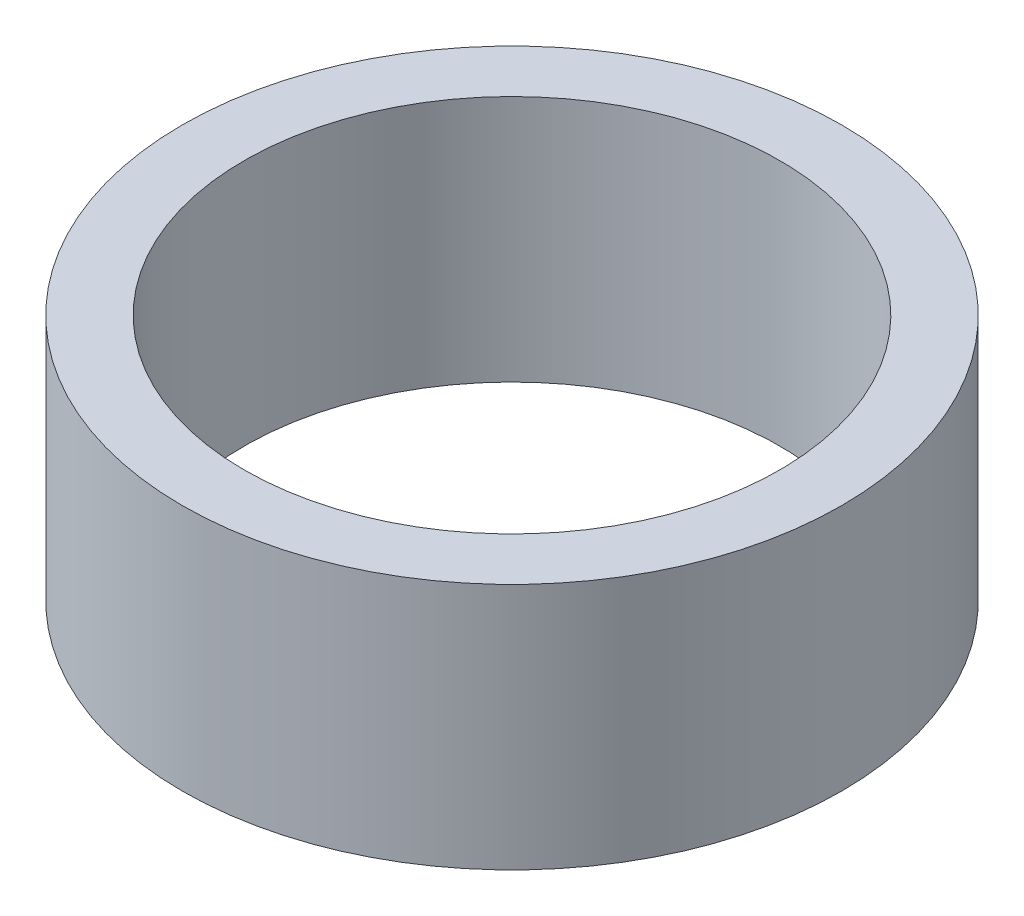
from build123d import *

# Parameters (mm, degrees)
SKETCH_1_R      = 4
SKETCH_1_R_2    = 3.25
EXTRUDE_1_DEPTH = 3


with BuildPart() as part:
    # Эскиз1 → Бобышка-Вытянуть1 (new body)
    with BuildSketch(Plane(origin=(0, 0, 0), x_dir=(1, 0, 0), z_dir=(0, 1, 0))):
        with Locations(Location((0, 0, 0), (0, 0, 270))):
            Circle(SKETCH_1_R)
        with Locations(Location((0, 0, 0), (0, 0, 270))):
            Circle(SKETCH_1_R_2, mode=Mode.SUBTRACT)
    extrude(amount=EXTRUDE_1_DEPTH)


solid = part.part
